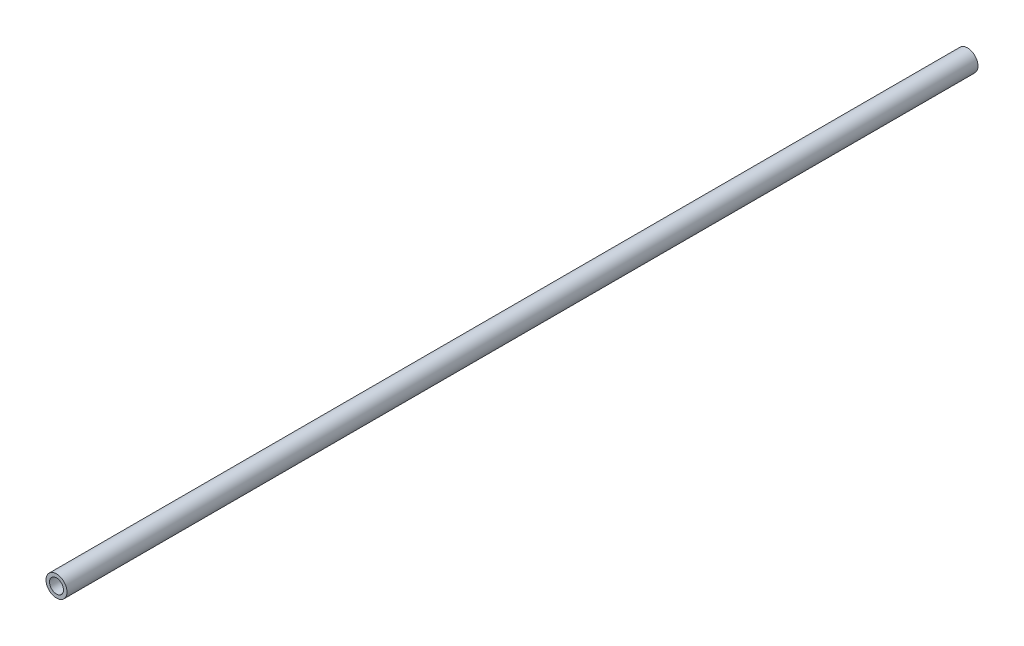
from build123d import *

# Parameters (mm, degrees)
SKETCH_1_R      = 3
SKETCH_1_R_2    = 2
EXTRUDE_1_DEPTH = 260


with BuildPart() as part:
    # 草图1 → 凸台-拉伸1 (new body)
    with BuildSketch(Plane.XY):
        Circle(SKETCH_1_R)
        Circle(SKETCH_1_R_2, mode=Mode.SUBTRACT)
    extrude(amount=EXTRUDE_1_DEPTH)


solid = part.part
